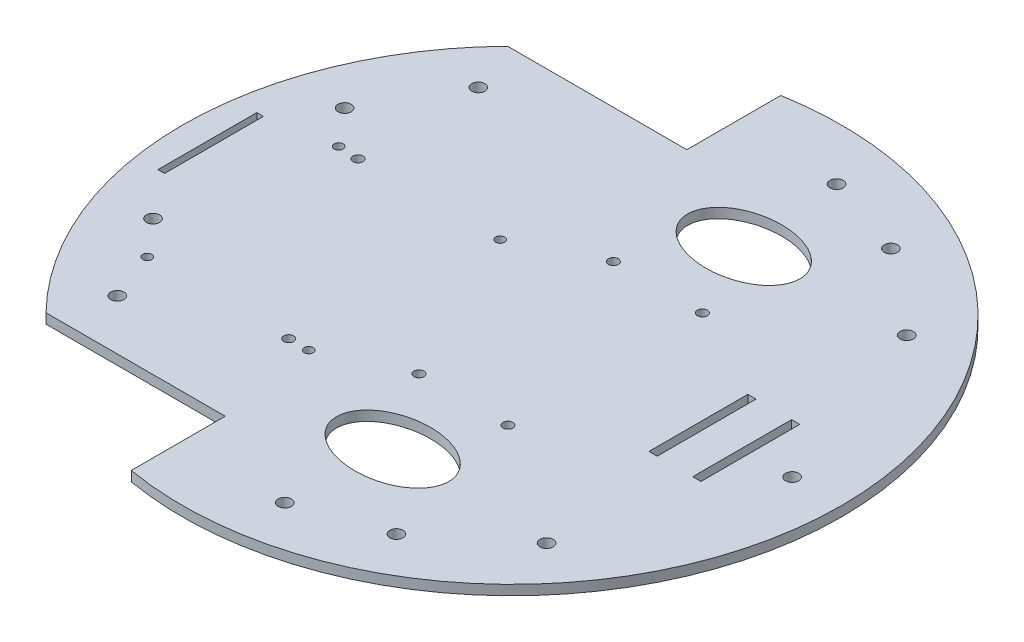
from build123d import *

# Parameters (mm, degrees)
SKETCH_1_R          = 100
EXTRUDE_1_DEPTH     = 3
SKETCH_2_R          = 2
CUT_EXTRUDE_1_DEPTH = 10
SKETCH_4_W          = 70
SKETCH_4_H          = 35
CUT_EXTRUDE_2_DEPTH = 10
SKETCH_5_R          = 2
CUT_EXTRUDE_3_DEPTH = 10
SKETCH_6_W          = 3
SKETCH_6_H          = 25
EXTRUDE_2_DEPTH     = 25
SKETCH_7_R          = 1
CUT_EXTRUDE_4_DEPTH = 30
CHAMFER_1_SIZE      = 10
CHAMFER_2_SIZE      = 10
CHAMFER_3_SIZE      = 5
SKETCH_11_W         = 2
SKETCH_11_H         = 30
CUT_EXTRUDE_5_DEPTH = 30
SKETCH_12_R         = 1.5
SKETCH_12_R_2       = 1.364499713
CUT_EXTRUDE_6_DEPTH = 10
SKETCH_13_W         = 2.5
SKETCH_13_H         = 30
CUT_EXTRUDE_7_DEPTH = 10
SKETCH_14_RX        = 17.045359967
SKETCH_14_RY        = 11.452351228
CUT_EXTRUDE_8_DEPTH = 10


with BuildPart() as part:
    # Эскиз1 → Бобышка-Вытянуть1 (new body)
    with BuildSketch(Plane(origin=(0, 0, 0), x_dir=(1, 0, 0), z_dir=(0, 1, 0))):
        with Locations(Location((0, 0, 0), (0, 0, 270))):
            Circle(SKETCH_1_R)
    extrude(amount=EXTRUDE_1_DEPTH)

    # Эскиз2 → Вырез-Вытянуть1 (cut)
    with BuildSketch(Plane(origin=(0, 3, 0), x_dir=(1, 0, 0), z_dir=(0, 1, 0))):
        with Locations(Location((85, 0, 0), (0, 0, 270))):
            Circle(SKETCH_2_R)
        with Locations(Location((65.113777665, -54.636946823, 0), (0, 0, 270))):
            Circle(SKETCH_2_R)
        with Locations(Location((14.760095102, -83.708659006, 0), (0, 0, 270))):
            Circle(SKETCH_2_R)
        with Locations(Location((-42.5, -73.612159322, 0), (0, 0, 270))):
            Circle(SKETCH_2_R)
        with Locations(Location((-79.873872767, -29.071712183, 0), (0, 0, 270))):
            Circle(SKETCH_2_R)
        with Locations(Location((-79.873872767, 29.071712183, 0), (0, 0, 270))):
            Circle(SKETCH_2_R)
        with Locations(Location((-42.5, 73.612159322, 0), (0, 0, 270))):
            Circle(SKETCH_2_R)
        with Locations(Location((14.760095102, 83.708659006, 0), (0, 0, 270))):
            Circle(SKETCH_2_R)
        with Locations(Location((65.113777665, 54.636946823, 0), (0, 0, 270))):
            Circle(SKETCH_2_R)
    extrude(amount=-CUT_EXTRUDE_1_DEPTH, mode=Mode.SUBTRACT)

    # Эскиз4 → Вырез-Вытянуть2 (cut)
    with BuildSketch(Plane(origin=(0, 3, 0), x_dir=(1, 0, 0), z_dir=(0, 1, 0))):
        with Locations((-52, -87.543045262)):
            Rectangle(SKETCH_4_W, SKETCH_4_H)
        with Locations((-52, 87.543045262)):
            Rectangle(SKETCH_4_W, SKETCH_4_H)
    extrude(amount=-CUT_EXTRUDE_2_DEPTH, mode=Mode.SUBTRACT)

    # Эскиз5 → Вырез-Вытянуть3 (cut)
    with BuildSketch(Plane(origin=(0, 3, 0), x_dir=(1, 0, 0), z_dir=(0, 1, 0))):
        with Locations(Location((39.936936383, -75.033599889, 0), (0, 0, 270))):
            Circle(SKETCH_5_R)
        with Locations(Location((39.936936383, 75.033599889, 0), (0, 0, 270))):
            Circle(SKETCH_5_R)
        with Locations(Location((-65, 54.772255751, 0), (0, 0, 270))):
            Circle(SKETCH_5_R)
        with Locations(Location((-65, -54.772255751, 0), (0, 0, 270))):
            Circle(SKETCH_5_R)
    extrude(amount=-CUT_EXTRUDE_3_DEPTH, mode=Mode.SUBTRACT)

    # Эскиз6 → Бобышка-Вытянуть2 (add)
    with BuildSketch(Plane.XZ):
        with Locations((-88.5, 0)):
            Rectangle(SKETCH_6_W, SKETCH_6_H)
    extrude(amount=EXTRUDE_2_DEPTH)

    # Эскиз7 → Вырез-Вытянуть4 (cut)
    with BuildSketch(Plane.ZY.offset(90)):
        with Locations((-10, -22.5)):
            Circle(SKETCH_7_R)
        with Locations((10, -22.5)):
            Circle(SKETCH_7_R)
        with Locations((-10, -8.5)):
            Circle(SKETCH_7_R)
        with Locations((10, -8.5)):
            Circle(SKETCH_7_R)
    extrude(amount=-CUT_EXTRUDE_4_DEPTH, mode=Mode.SUBTRACT)

    # Фаска1
    chamfer_1_edges = [part.edges().sort_by_distance(p)[0] for p in [
        (-88.5, 0, -12.5),
    ]]
    chamfer(chamfer_1_edges, length=CHAMFER_1_SIZE)

    # Фаска2
    chamfer_2_edges = [part.edges().sort_by_distance(p)[0] for p in [
        (-88.5, 0, 12.5),
    ]]
    chamfer(chamfer_2_edges, length=CHAMFER_2_SIZE)

    # Фаска3
    chamfer_3_edges = [part.edges().sort_by_distance(p)[0] for p in [
        (-87, 0, 0),
    ]]
    chamfer(chamfer_3_edges, length=CHAMFER_3_SIZE)

    # Эскиз11 → Вырез-Вытянуть5 (cut)
    with BuildSketch(Plane.XZ):
        with Locations((-91, 0.438486228)):
            Rectangle(SKETCH_11_W, SKETCH_11_H)
    extrude(amount=-CUT_EXTRUDE_5_DEPTH, mode=Mode.SUBTRACT)

    # Эскиз12 → Вырез-Вытянуть6 (cut)
    with BuildSketch(Plane.XZ):
        with Locations(Location((1.260095102, -29.5, 0), (0, 0, 270))):
            Circle(SKETCH_12_R)
        with Locations(Location((1.260095102, 29.5, 0), (0, 0, 270))):
            Circle(SKETCH_12_R)
        with Locations(Location((28.260095102, -29.5, 0), (0, 0, 270))):
            Circle(SKETCH_12_R)
        with Locations(Location((28.260095102, 29.5, 0), (0, 0, 270))):
            Circle(SKETCH_12_R)
        with Locations(Location((-70.688878581, 40, 0), (0, 0, 270))):
            Circle(SKETCH_12_R_2)
        with Locations(Location((-27.73782315, 40.032744033, 0), (0, 0, 270))):
            Circle(SKETCH_12_R)
        with Locations(Location((-21.688878581, 40, 0), (0, 0, 270))):
            Circle(SKETCH_12_R_2)
        with Locations(Location((-21.688878581, -18.085512482, 0), (0, 0, 270))):
            Circle(SKETCH_12_R_2)
        with Locations(Location((-64.489792506, -17.736958402, 0), (0, 0, 270))):
            Circle(SKETCH_12_R)
        with Locations(Location((-70.688878581, -18.085512482, 0), (0, 0, 270))):
            Circle(SKETCH_12_R_2)
    extrude(amount=-CUT_EXTRUDE_6_DEPTH, mode=Mode.SUBTRACT)

    # Эскиз13 → Вырез-Вытянуть7 (cut)
    with BuildSketch(Plane.XZ):
        with Locations((57.794423637, 0)):
            Rectangle(SKETCH_13_W, SKETCH_13_H)
        with Locations((71.075546462, 0)):
            Rectangle(SKETCH_13_W, SKETCH_13_H)
    extrude(amount=-CUT_EXTRUDE_7_DEPTH, mode=Mode.SUBTRACT)

    # Эскиз14 → Вырез-Вытянуть8 (cut)
    with BuildSketch(Plane.XZ):
        with Locations(Location((17.045359967, 53.266749896), (0, 0, 180))):
            Ellipse(SKETCH_14_RX, SKETCH_14_RY)
        with Locations(Location((17.045359967, -53.266749896), (0, 0, 180))):
            Ellipse(SKETCH_14_RX, SKETCH_14_RY)
    extrude(amount=-CUT_EXTRUDE_8_DEPTH, mode=Mode.SUBTRACT)


solid = part.part
